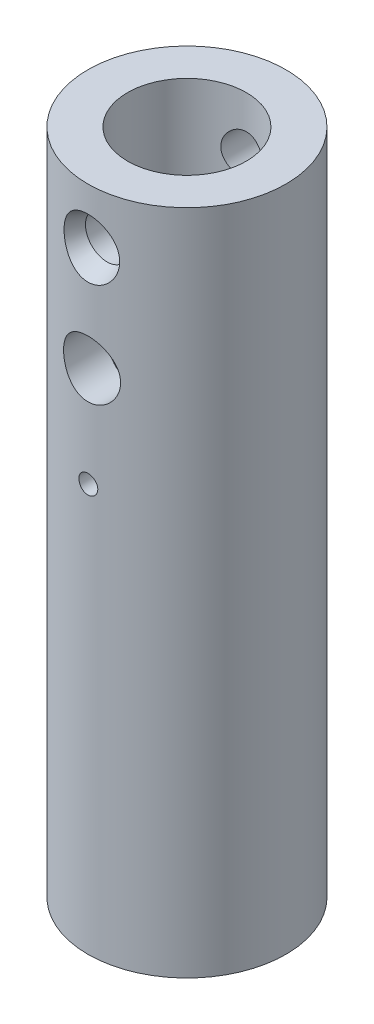
from build123d import *

# Parameters (mm, degrees)
SKETCH1_R                             = 7.9375
BOSS_EXTRUDE1_DEPTH                   = 53.467
F_29_0_136_DIAMETER_HOLE1_D           = 3.4544
F_29_0_136_DIAMETER_HOLE1_CSINK_D     = 4.7244
F_29_0_136_DIAMETER_HOLE1_CSINK_ANGLE = 45
F_15_0_18_DIAMETER_HOLE1_D            = 4.572
F_53_0_0595_DIAMETER_HOLE1_D          = 1.5113
F_3_8_0_375_DIAMETER_HOLE1_D          = 9.525
F_3_8_0_375_DIAMETER_HOLE1_DEPTH      = 50.8
F_3_8_0_375_DIAMETER_HOLE1_TIP        = 2.861598698
F_39_0_0995_DIAMETER_HOLE1_D          = 2.54


with BuildPart() as part:
    # Sketch1 → Boss-Extrude1 (new body)
    with BuildSketch(Plane(origin=(0, 0, 0), x_dir=(1, 0, 0), z_dir=(0, 1, 0))):
        with Locations(Location((0, 0, 0), (0, 0, 270))):
            Circle(SKETCH1_R)
    extrude(amount=BOSS_EXTRUDE1_DEPTH)

    # #29 (0.136) Diameter Hole1 (through all)
    with Locations(Plane.XY.offset(7.9375)):
        with Locations((0, 49.022)):
            CounterSinkHole(F_29_0_136_DIAMETER_HOLE1_D / 2, F_29_0_136_DIAMETER_HOLE1_CSINK_D / 2, counter_sink_angle=F_29_0_136_DIAMETER_HOLE1_CSINK_ANGLE)

    # #15 (0.18) Diameter Hole1 (through all)
    with Locations(Plane.XY.offset(7.9375)):
        with Locations((0, 40.64)):
            Hole(F_15_0_18_DIAMETER_HOLE1_D / 2)

    # #53 (0.0595) Diameter Hole1 (through all)
    with Locations(Plane.XY.offset(7.9375)):
        with Locations((0, 32.639)):
            Hole(F_53_0_0595_DIAMETER_HOLE1_D / 2)

    # 3/8 (0.375) Diameter Hole1
    with Locations(Plane(origin=(0, 53.467, 0), x_dir=(1, 0, 0), z_dir=(0, 1, 0))):
        with Locations((0, 0)):
            Hole(F_3_8_0_375_DIAMETER_HOLE1_D / 2, depth=F_3_8_0_375_DIAMETER_HOLE1_DEPTH)
            with Locations((0, 0, -(F_3_8_0_375_DIAMETER_HOLE1_DEPTH + F_3_8_0_375_DIAMETER_HOLE1_TIP / 2))):  # 118° drill point
                Cone(0, F_3_8_0_375_DIAMETER_HOLE1_D / 2, F_3_8_0_375_DIAMETER_HOLE1_TIP, mode=Mode.SUBTRACT)

    # #39 (0.0995) Diameter Hole1 (through all)
    with Locations(Plane(origin=(0, 0, 0), x_dir=(-1, 0, 0), z_dir=(0, -1, 0))):
        with Locations((0, 0)):
            Hole(F_39_0_0995_DIAMETER_HOLE1_D / 2)


solid = part.part
